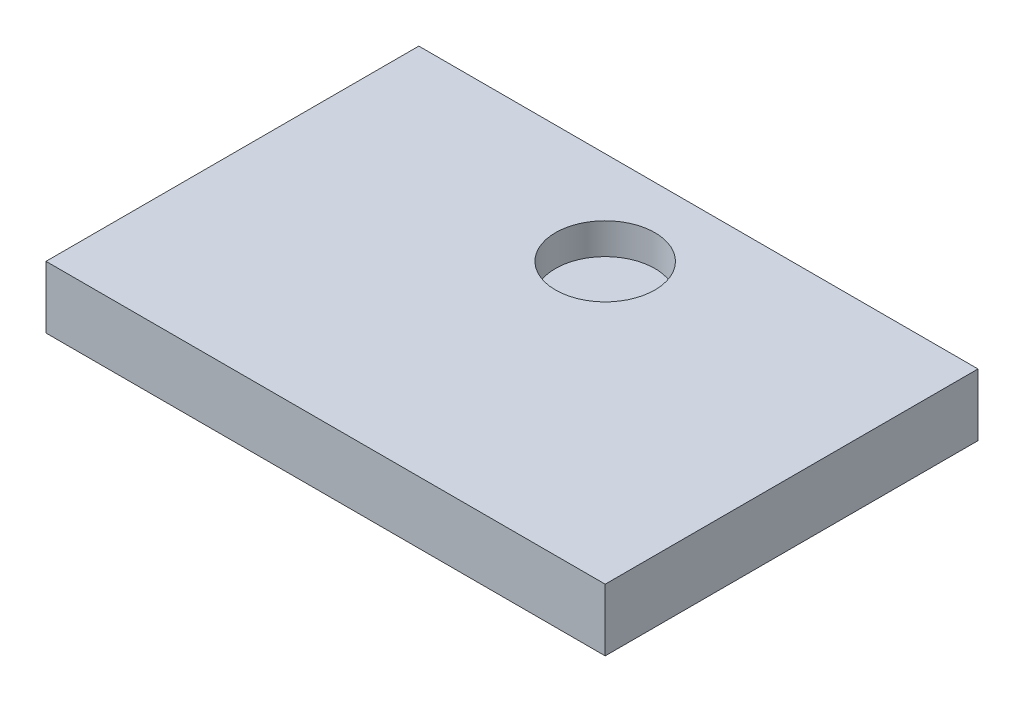
from build123d import *

# Parameters (mm, degrees)
SKETCH1_W      = 90
SKETCH1_H      = 60
EXTRUDE1_DEPTH = 10
SKETCH2_R      = 8
EXTRUDE2_DEPTH = 5


with BuildPart() as part:
    # Sketch1 → Extrude1 (new body)
    with BuildSketch(Plane(origin=(0, 0, 0), x_dir=(1, 0, 0), z_dir=(0, 1, 0))):
        with Locations((45, 30)):
            Rectangle(SKETCH1_W, SKETCH1_H)
    extrude(amount=EXTRUDE1_DEPTH)

    # Sketch2 → Extrude2 (cut)
    with BuildSketch(Plane(origin=(0, 10, 0), x_dir=(1, 0, 0), z_dir=(0, 1, 0))):
        with Locations(Location((45, 45, 0), (0, 0, 270))):
            Circle(SKETCH2_R)
    extrude(amount=-EXTRUDE2_DEPTH, mode=Mode.SUBTRACT)


solid = part.part
